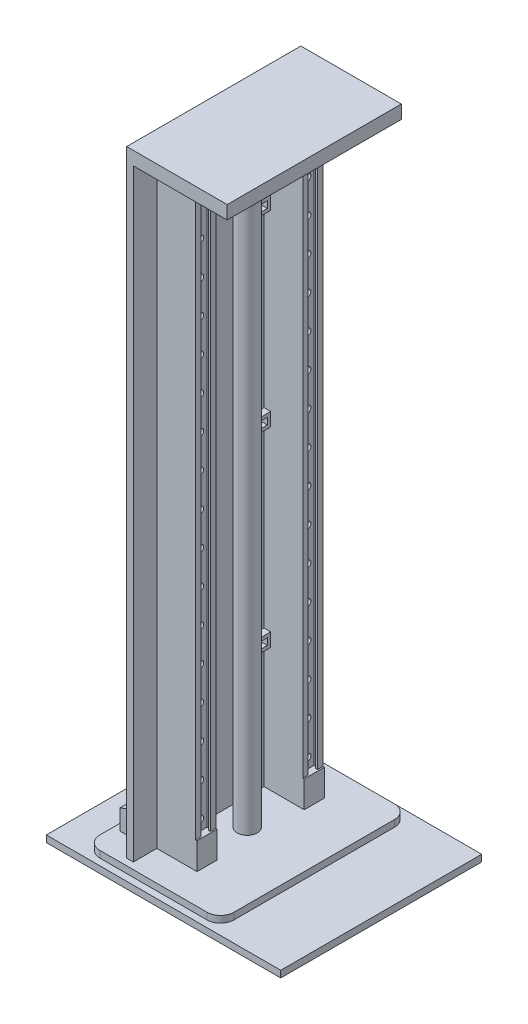
from build123d import *

# Parameters (mm, degrees)
EXTRUDE_1_DEPTH          = 10
EXTRUDE_2_DEPTH          = 10
EXTRUDE_3_DEPTH          = 900
SKETCH_4_W               = 40
SKETCH_4_H               = 15
EXTRUDE_4_DEPTH          = 45
CUT_EXTRUDE_1_DEPTH      = 975.114982946
CUT_EXTRUDE_1_DEPTH_BACK = 975.114982946
SKETCH_6_W               = 150
SKETCH_6_H               = 260
EXTRUDE_5_DEPTH          = 20
EXTRUDE_6_DEPTH          = 60
EXTRUDE_7_REACH          = 955.362
SKETCH_8_R               = 15
SKETCH_11_R              = 24
SKETCH_11_R_2            = 18
EXTRUDE_10_DEPTH         = 15
SKETCH_12_W              = 30
SKETCH_12_H              = 860
CUT_EXTRUDE_3_DEPTH      = 10
SKETCH_13_W              = 5
SKETCH_13_H              = 860
EXTRUDE_11_DEPTH         = 5
SKETCH_14_W              = 8
SKETCH_14_H              = 860
EXTRUDE_12_DEPTH         = 3
SKETCH_17_R              = 5
CUT_EXTRUDE_4_DEPTH      = 5
SKETCH_20_W              = 20
SKETCH_20_H              = 20
EXTRUDE_13_DEPTH         = 10
SKETCH_23_W              = 10
SKETCH_23_H              = 10
CUT_EXTRUDE_8_DEPTH      = 20


with BuildPart() as part:
    # 草图1 → 凸台-拉伸1 (new body)
    with BuildSketch(Plane(origin=(0, 0, 0), x_dir=(1, 0, 0), z_dir=(0, 1, 0))):
        Polygon((-150, 50), (-150, 150), (200, 150), (200, -150), (-150, -150), align=None)
    extrude(amount=EXTRUDE_1_DEPTH)

    # 草图2 → 凸台-拉伸2 (add)
    with BuildSketch(Plane(origin=(0, 10, 0), x_dir=(1, 0, 0), z_dir=(0, 1, 0))):
        with BuildLine():
            Line((-100, -20), (-100, 120))
            ThreePointArc((-100, 120), (-94.142135624, 134.142135624), (-80, 140))
            Line((-80, 140), (80, 140))
            ThreePointArc((80, 140), (94.142135624, 134.142135624), (100, 120))
            Line((100, 120), (100, -120))
            ThreePointArc((100, -120), (94.142135624, -134.142135624), (80, -140))
            Line((80, -140), (-80, -140))
            ThreePointArc((-80, -140), (-94.142135624, -134.142135624), (-100, -120))
            Line((-100, -120), (-100, -20))
        make_face()
    extrude(amount=EXTRUDE_2_DEPTH)

    # 草图3 → 凸台-拉伸3 (add)
    with BuildSketch(Plane(origin=(0, 20, 0), x_dir=(1, 0, 0), z_dir=(0, 1, 0))):
        Polygon((-50, 100), (-50, -100), (-50, -130), (-40, -130), (-40, 130), (-50, 130), align=None)
    extrude(amount=EXTRUDE_3_DEPTH)

    # 草图4 → 凸台-拉伸4 (add)
    with BuildSketch(Plane(origin=(0, 20, 0), x_dir=(1, 0, 0), z_dir=(0, 1, 0))):
        with Locations((-70, -92.5)):
            Rectangle(SKETCH_4_W, SKETCH_4_H)
        with Locations((-70, 92.5)):
            Rectangle(SKETCH_4_W, SKETCH_4_H)
    extrude(amount=EXTRUDE_4_DEPTH)

    # 草图5 → 切除-拉伸1 (cut, two sides: drawn at the far end of the back side and taken through both)
    with BuildSketch(Plane(origin=(0, 0, -100), x_dir=(-1, 0, 0), z_dir=(0, 0, -1)).offset(-CUT_EXTRUDE_1_DEPTH_BACK)):
        Polygon((90, 65), (90, 50), (50, 65), align=None)
    extrude(amount=CUT_EXTRUDE_1_DEPTH + CUT_EXTRUDE_1_DEPTH_BACK, mode=Mode.SUBTRACT)

    # 草图6 → 凸台-拉伸5 (add)
    with BuildSketch(Plane(origin=(0, 920, 0), x_dir=(1, 0, 0), z_dir=(0, 1, 0))):
        with Locations((25, 0)):
            Rectangle(SKETCH_6_W, SKETCH_6_H)
    extrude(amount=EXTRUDE_5_DEPTH)

    # 草图7 → 凸台-拉伸6 (add)
    with BuildSketch(Plane(origin=(-40, 0, 0), x_dir=(0, 0, -1), z_dir=(1, 0, 0))):
        Polygon((-95, 920), (-65, 920), (-65, 60), (-65, 20), (-95, 20), (-95, 60), align=None)
        Polygon((95, 920), (65, 920), (65, 60), (65, 20), (95, 20), (95, 60), align=None)
    extrude(amount=EXTRUDE_6_DEPTH)

    # 草图8 → 凸台-拉伸7 (add, up to next)
    with BuildSketch(Plane(origin=(0, 20, 0), x_dir=(1, 0, 0), z_dir=(0, 1, 0)), mode=Mode.PRIVATE) as extrude_7_sk1:
        with Locations(Location((0, 0, 0), (0, 0, 90))):
            Circle(SKETCH_8_R)
    extrude_7_tool1 = extrude(extrude_7_sk1.sketch, amount=EXTRUDE_7_REACH, mode=Mode.PRIVATE) - part.part
    add(extrude_7_tool1.solids().sort_by_distance((0, 20, 0))[0])

    # 草图11 → 凸台-拉伸10 (add)
    with BuildSketch(Plane.XZ.offset(-920)):
        with Locations(Location((0, 0, 0), (0, 0, 90))):
            Circle(SKETCH_11_R)
        with Locations(Location((0, 0, 0), (0, 0, 270))):
            Circle(SKETCH_11_R_2, mode=Mode.SUBTRACT)
    extrude(amount=EXTRUDE_10_DEPTH)

    # 草图12 → 切除-拉伸3 (cut)
    with BuildSketch(Plane(origin=(20, 0, 0), x_dir=(0, 0, -1), z_dir=(1, 0, 0))):
        with Locations((80, 490)):
            Rectangle(SKETCH_12_W, SKETCH_12_H)
        with Locations((-80, 490)):
            Rectangle(SKETCH_12_W, SKETCH_12_H)
    extrude(amount=-CUT_EXTRUDE_3_DEPTH, mode=Mode.SUBTRACT)

    # 草图13 → 凸台-拉伸11 (add)
    with BuildSketch(Plane(origin=(10, 0, 0), x_dir=(0, 0, -1), z_dir=(1, 0, 0))):
        with Locations((-92.5, 490)):
            Rectangle(SKETCH_13_W, SKETCH_13_H)
        with Locations((-67.5, 490)):
            Rectangle(SKETCH_13_W, SKETCH_13_H)
        with Locations((67.5, 490)):
            Rectangle(SKETCH_13_W, SKETCH_13_H)
        with Locations((92.5, 490)):
            Rectangle(SKETCH_13_W, SKETCH_13_H)
    extrude(amount=EXTRUDE_11_DEPTH)

    # 草图14 → 凸台-拉伸12 (add)
    with BuildSketch(Plane(origin=(15, 0, 0), x_dir=(0, 0, -1), z_dir=(1, 0, 0))):
        with Locations((-91, 490)):
            Rectangle(SKETCH_14_W, SKETCH_14_H)
        with Locations((-69, 490)):
            Rectangle(SKETCH_14_W, SKETCH_14_H)
        with Locations((69, 490)):
            Rectangle(SKETCH_14_W, SKETCH_14_H)
        with Locations((91, 490)):
            Rectangle(SKETCH_14_W, SKETCH_14_H)
    extrude(amount=EXTRUDE_12_DEPTH)

    # 草图17 → 切除-拉伸4 (cut)
    with BuildSketch(Plane(origin=(10, 0, 0), x_dir=(0, 0, -1), z_dir=(1, 0, 0))):
        with Locations((-80, 675)):
            Circle(SKETCH_17_R)
        with Locations((-80, 625)):
            Circle(SKETCH_17_R)
        with Locations((-80, 575)):
            Circle(SKETCH_17_R)
        with Locations((-80, 525)):
            Circle(SKETCH_17_R)
        with Locations((-80, 475)):
            Circle(SKETCH_17_R)
        with Locations((-80, 425)):
            Circle(SKETCH_17_R)
        with Locations((-80, 375)):
            Circle(SKETCH_17_R)
        with Locations((-80, 325)):
            Circle(SKETCH_17_R)
        with Locations((-80, 275)):
            Circle(SKETCH_17_R)
        with Locations((-80, 225)):
            Circle(SKETCH_17_R)
        with Locations((-80, 175)):
            Circle(SKETCH_17_R)
        with Locations((-80, 125)):
            Circle(SKETCH_17_R)
        with Locations((-80, 75)):
            Circle(SKETCH_17_R)
        with Locations((80, 675)):
            Circle(SKETCH_17_R)
        with Locations((80, 625)):
            Circle(SKETCH_17_R)
        with Locations((80, 575)):
            Circle(SKETCH_17_R)
        with Locations((80, 525)):
            Circle(SKETCH_17_R)
        with Locations((80, 475)):
            Circle(SKETCH_17_R)
        with Locations((80, 425)):
            Circle(SKETCH_17_R)
        with Locations((80, 375)):
            Circle(SKETCH_17_R)
        with Locations((80, 325)):
            Circle(SKETCH_17_R)
        with Locations((80, 275)):
            Circle(SKETCH_17_R)
        with Locations((80, 225)):
            Circle(SKETCH_17_R)
        with Locations((80, 175)):
            Circle(SKETCH_17_R)
        with Locations((80, 125)):
            Circle(SKETCH_17_R)
        with Locations((80, 75)):
            Circle(SKETCH_17_R)
        with Locations((-80, 725)):
            Circle(SKETCH_17_R)
        with Locations((-80, 775)):
            Circle(SKETCH_17_R)
        with Locations((-80, 825)):
            Circle(SKETCH_17_R)
        with Locations((-80, 875)):
            Circle(SKETCH_17_R)
        with Locations((80, 725)):
            Circle(SKETCH_17_R)
        with Locations((80, 775)):
            Circle(SKETCH_17_R)
        with Locations((80, 825)):
            Circle(SKETCH_17_R)
        with Locations((80, 875)):
            Circle(SKETCH_17_R)
    extrude(amount=-CUT_EXTRUDE_4_DEPTH, mode=Mode.SUBTRACT)

    # 草图20 → 凸台-拉伸13 (add)
    with BuildSketch(Plane(origin=(-40, 0, 0), x_dir=(0, 0, -1), z_dir=(1, 0, 0))):
        with Locations((-55, 215)):
            Rectangle(SKETCH_20_W, SKETCH_20_H)
        with Locations((55, 215)):
            Rectangle(SKETCH_20_W, SKETCH_20_H)
        with Locations((-55, 500)):
            Rectangle(SKETCH_20_W, SKETCH_20_H)
        with Locations((-55, 780)):
            Rectangle(SKETCH_20_W, SKETCH_20_H)
        with Locations((55, 500)):
            Rectangle(SKETCH_20_W, SKETCH_20_H)
        with Locations((55, 780)):
            Rectangle(SKETCH_20_W, SKETCH_20_H)
    extrude(amount=EXTRUDE_13_DEPTH)

    # 草图23 → 切除-拉伸8 (cut)
    with BuildSketch(Plane(origin=(-30, 0, 0), x_dir=(0, 0, -1), z_dir=(1, 0, 0))):
        with Locations((-55, 780)):
            Rectangle(SKETCH_23_W, SKETCH_23_H)
        with Locations((-55, 500)):
            Rectangle(SKETCH_23_W, SKETCH_23_H)
        with Locations((-55, 215)):
            Rectangle(SKETCH_23_W, SKETCH_23_H)
        with Locations((55, 215)):
            Rectangle(SKETCH_23_W, SKETCH_23_H)
        with Locations((55, 500)):
            Rectangle(SKETCH_23_W, SKETCH_23_H)
        with Locations((55, 780)):
            Rectangle(SKETCH_23_W, SKETCH_23_H)
    extrude(amount=-CUT_EXTRUDE_8_DEPTH, mode=Mode.SUBTRACT)


solid = part.part
